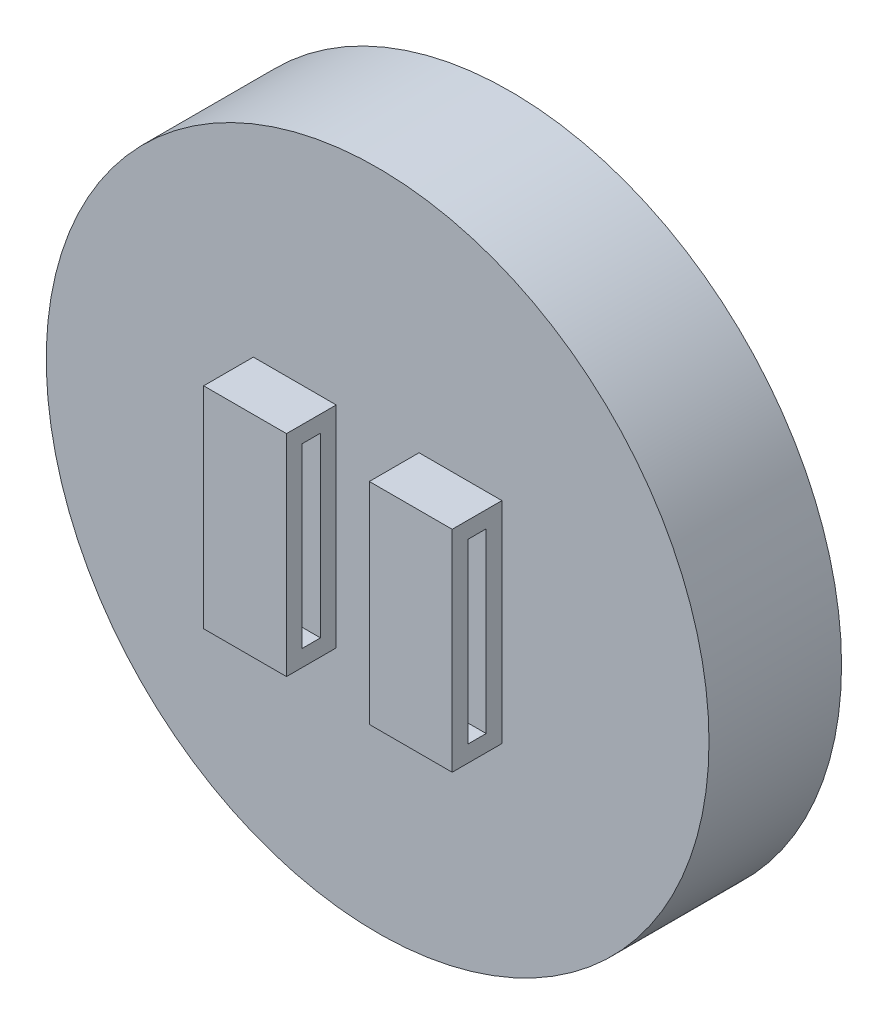
from build123d import *

# Parameters (mm, degrees)
SKETCH1_R           = 20
BOSS_EXTRUDE1_DEPTH = 8
SKETCH2_R           = 16
CUT_EXTRUDE1_DEPTH  = 6.35
SKETCH3_W           = 5
SKETCH3_H           = 6.35
BOSS_EXTRUDE2_DEPTH = 3
CUT_EXTRUDE2_DEPTH  = 177.8


with BuildPart() as part:
    # Sketch1 → Boss-Extrude1 (new body)
    with BuildSketch(Plane.XY):
        Circle(SKETCH1_R)
    extrude(amount=BOSS_EXTRUDE1_DEPTH)

    # Sketch2 → Cut-Extrude1 (cut)
    with BuildSketch(Plane(origin=(0, 0, 0), x_dir=(-1, 0, 0), z_dir=(0, 0, -1))):
        Circle(SKETCH2_R)
    extrude(amount=-CUT_EXTRUDE1_DEPTH, mode=Mode.SUBTRACT)

    # Sketch3 → Boss-Extrude2 (add)
    with BuildSketch(Plane.XY.offset(8)):
        with Locations((-5, -3.175)):
            Rectangle(SKETCH3_W, SKETCH3_H)
        with Locations((-5, 3.175)):
            Rectangle(SKETCH3_W, SKETCH3_H)
        with Locations((5, 3.175)):
            Rectangle(SKETCH3_W, SKETCH3_H)
        with Locations((5, -3.175)):
            Rectangle(SKETCH3_W, SKETCH3_H)
    extrude(amount=BOSS_EXTRUDE2_DEPTH)

    # Sketch6 → Cut-Extrude2 (cut)
    with BuildSketch(Plane.ZY.offset(7.5)):
        Polygon((10.05, -5.35), (10.05, -2.328333333), (8.95, 2.328333333), (8.95, -5.35), align=None)
        Polygon((8.95, 2.328333333), (10.05, -2.328333333), (10.05, 5.35), (8.95, 5.35), align=None)
    extrude(amount=-CUT_EXTRUDE2_DEPTH, mode=Mode.SUBTRACT)


solid = part.part
